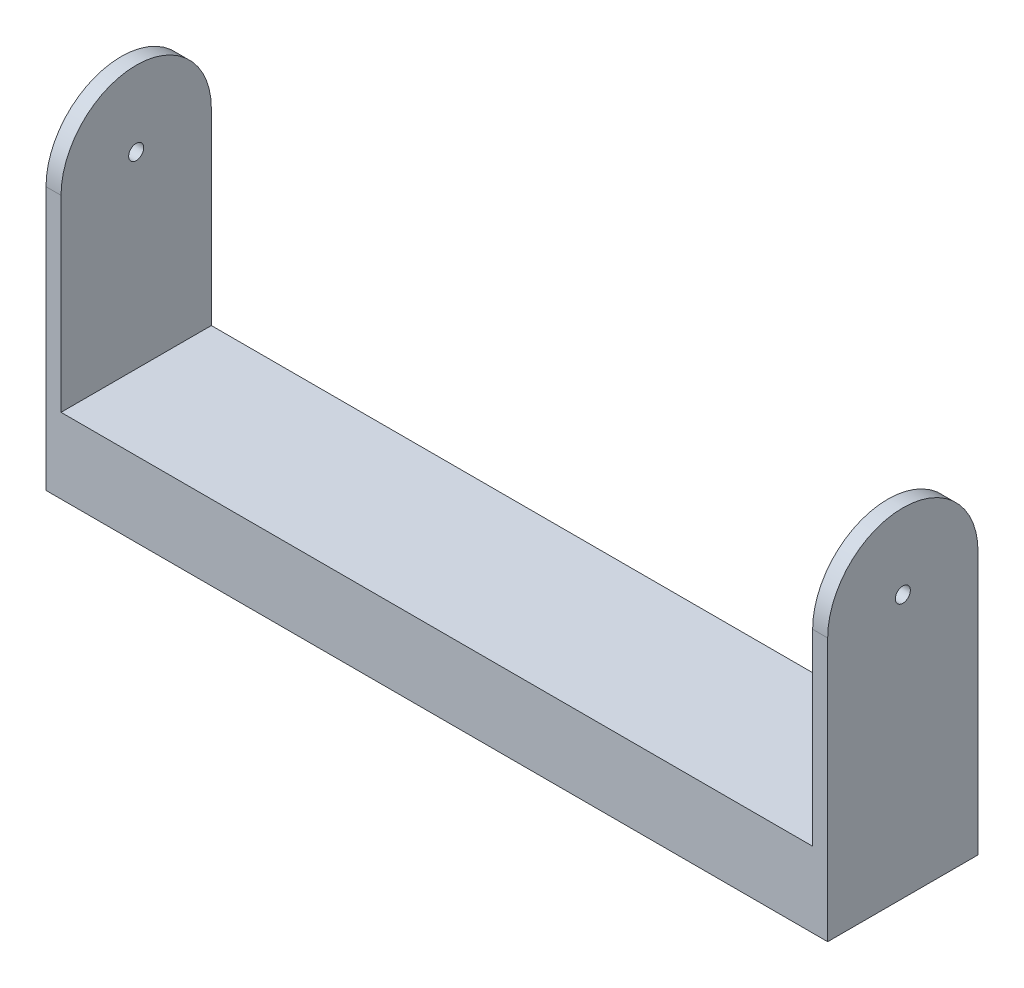
from build123d import *

# Parameters (mm, degrees)
SKETCH1_W               = 1040
SKETCH1_H               = 100
BOSS_EXTRUDE1_DEPTH     = 200
BOSS_EXTRUDE3_DEPTH     = 20
CUT_EXTRUDE1_DEPTH      = 1097.76797911
CUT_EXTRUDE1_DEPTH_BACK = 1097.76797911
SKETCH3_R               = 10


with BuildPart() as part:
    # Sketch1 → Boss-Extrude1 (new body)
    with BuildSketch(Plane.XY):
        with Locations((520, -50)):
            Rectangle(SKETCH1_W, SKETCH1_H)
    extrude(amount=BOSS_EXTRUDE1_DEPTH)

    # Sketch2 → Boss-Extrude3 (add)
    with BuildSketch(Plane(origin=(1040, 0, 0), x_dir=(0, 0, -1), z_dir=(1, 0, 0))):
        with BuildLine():
            Line((-200, 0), (-200, 250))
            ThreePointArc((-200, 250), (-100, 350), (0, 250))
            Line((0, 250), (0, 0))
            Line((0, 0), (-200, 0))
        make_face()
    boss_extrude3 = extrude(amount=-BOSS_EXTRUDE3_DEPTH)

    # Mirror2: Boss-Extrude3 across plane
    add(boss_extrude3.mirror(Plane(origin=(520, 0, 0), x_dir=(0, 0, 1), z_dir=(1, 0, 0))))

    # Sketch3 → Cut-Extrude1 (cut, two sides: drawn at the far end of the back side and taken through both)
    with BuildSketch(Plane(origin=(20, 0, 0), x_dir=(0, 0, -1), z_dir=(1, 0, 0)).offset(-CUT_EXTRUDE1_DEPTH_BACK)):
        with Locations(Location((-100, 250, 0), (0, 0, 90))):
            Circle(SKETCH3_R)
    extrude(amount=CUT_EXTRUDE1_DEPTH + CUT_EXTRUDE1_DEPTH_BACK, mode=Mode.SUBTRACT)


solid = part.part
